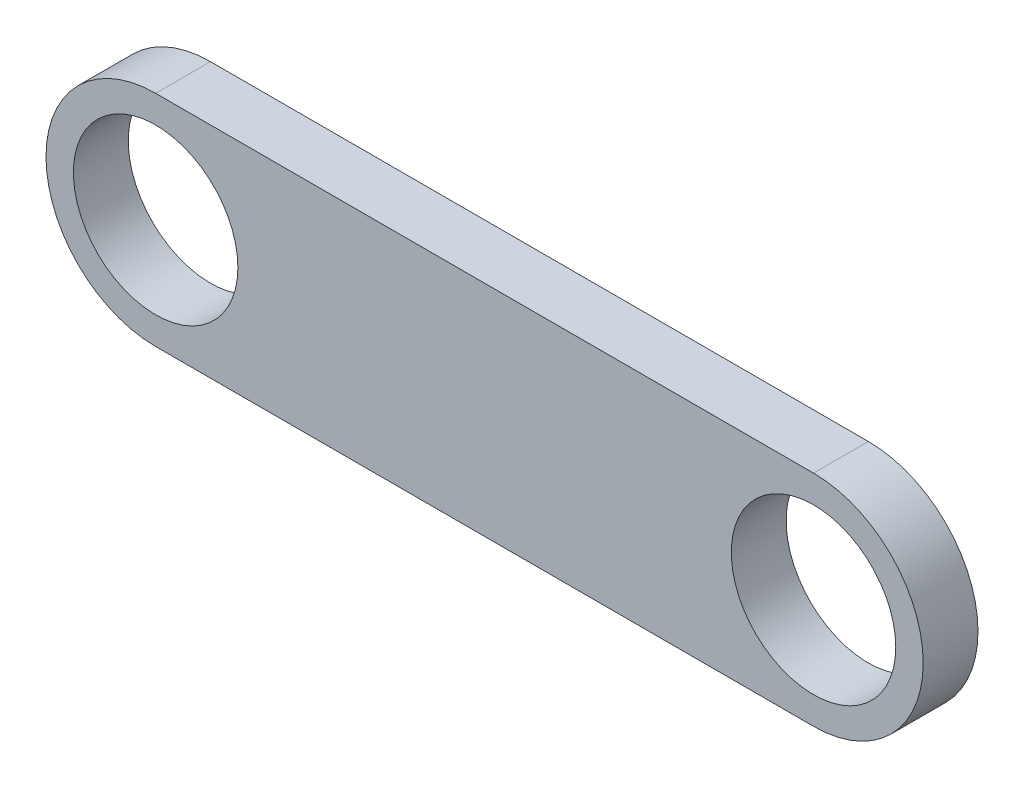
from build123d import *

# Parameters (mm, degrees)
SKETCH_1_R      = 15
EXTRUDE_1_DEPTH = 10


with BuildPart() as part:
    # Эскиз1 → Бобышка-Вытянуть1 (new body)
    with BuildSketch(Plane.XY):
        with BuildLine():
            Line((0, 20), (120, 20))
            ThreePointArc((120, 20), (140, 0), (120, -20))
            Line((120, -20), (0, -20))
            ThreePointArc((0, -20), (-20, 0), (0, 20))
        make_face()
        Circle(SKETCH_1_R, mode=Mode.SUBTRACT)
        with Locations((120, 0)):
            Circle(SKETCH_1_R, mode=Mode.SUBTRACT)
    extrude(amount=EXTRUDE_1_DEPTH)


solid = part.part
